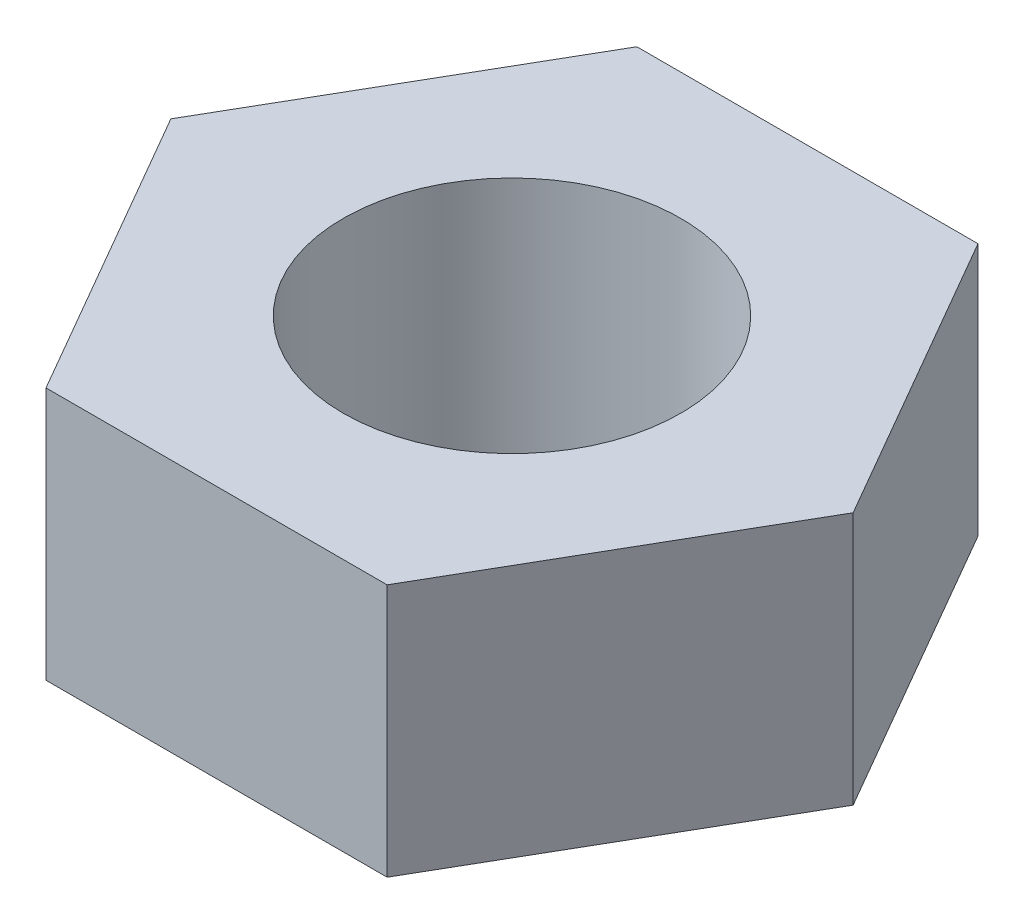
from build123d import *

# Parameters (mm, degrees)
SKETCH1_R           = 2
BOSS_EXTRUDE1_DEPTH = 3


with BuildPart() as part:
    # Sketch1 → Boss-Extrude1 (new body)
    with BuildSketch(Plane(origin=(0, 0, 0), x_dir=(1, 0, 0), z_dir=(0, 1, 0))):
        Polygon((4.041451884, 0), (2.020725942, 3.5), (-2.020725942, 3.5), (-4.041451884, 0), (-2.020725942, -3.5), (2.020725942, -3.5), align=None)
        with Locations(Location((0, 0, 0), (0, 0, 270))):
            Circle(SKETCH1_R, mode=Mode.SUBTRACT)
    extrude(amount=BOSS_EXTRUDE1_DEPTH)


solid = part.part
